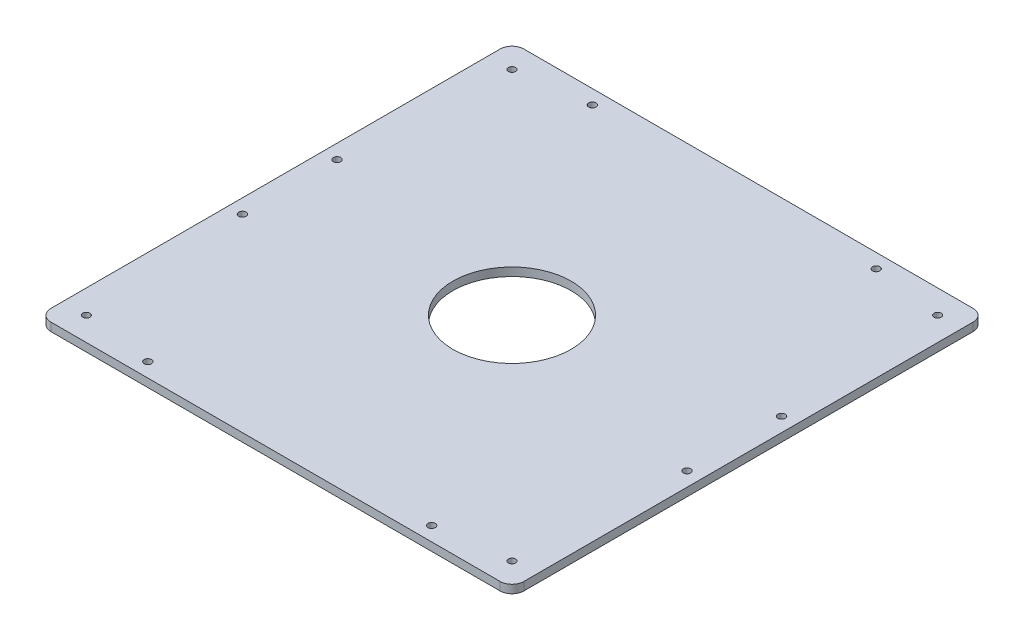
from build123d import *

# Parameters (mm, degrees)
SKETCH_1_R      = 1.55
SKETCH_1_R_2    = 25
SKETCH_1_R_3    = 1.5
EXTRUDE_1_DEPTH = 3.5
FILLET_1_R      = 5


with BuildPart() as part:
    # 草图1 → 凸台-拉伸1 (new body)
    with BuildSketch(Plane(origin=(0, 0, 0), x_dir=(1, 0, 0), z_dir=(0, 1, 0))):
        Polygon((-100, 100), (100, 100), (100, -32.687538375), (100, -80.687538375), (100, -100), (-100, -100), (-100, -80.687538375), (-100, -32.687538375), align=None)
        with Locations(Location((60, 94, 0), (0, 0, 270))):
            Circle(SKETCH_1_R, mode=Mode.SUBTRACT)
        with Locations(Location((60, -94, 0), (0, 0, 270))):
            Circle(SKETCH_1_R, mode=Mode.SUBTRACT)
        with Locations(Location((94, 20, 0), (0, 0, 270))):
            Circle(SKETCH_1_R, mode=Mode.SUBTRACT)
        with Locations(Location((94, -20, 0), (0, 0, 90))):
            Circle(SKETCH_1_R, mode=Mode.SUBTRACT)
        with Locations(Location((-60, -94, 0), (0, 0, 90))):
            Circle(SKETCH_1_R, mode=Mode.SUBTRACT)
        with Locations(Location((-94, -20, 0), (0, 0, 270))):
            Circle(SKETCH_1_R, mode=Mode.SUBTRACT)
        with Locations(Location((-94, 20, 0), (0, 0, 90))):
            Circle(SKETCH_1_R, mode=Mode.SUBTRACT)
        with Locations(Location((-60, 94, 0), (0, 0, 90))):
            Circle(SKETCH_1_R, mode=Mode.SUBTRACT)
        with Locations(Location((0, 0, 0), (0, 0, 270))):
            Circle(SKETCH_1_R_2, mode=Mode.SUBTRACT)
        with Locations(Location((-90, -90, 0), (0, 0, 270))):
            Circle(SKETCH_1_R_3, mode=Mode.SUBTRACT)
        with Locations(Location((-90, 90, 0), (0, 0, 90))):
            Circle(SKETCH_1_R_3, mode=Mode.SUBTRACT)
        with Locations(Location((90, 90, 0), (0, 0, 270))):
            Circle(SKETCH_1_R_3, mode=Mode.SUBTRACT)
        with Locations(Location((90, -90, 0), (0, 0, 90))):
            Circle(SKETCH_1_R_3, mode=Mode.SUBTRACT)
    extrude(amount=EXTRUDE_1_DEPTH)

    # 圆角1
    fillet_1_edges = [part.edges().sort_by_distance(p)[0] for p in [
        (-100, 1.75, -100),
        (100, 1.75, -100),
        (100, 1.75, 100),
        (-100, 1.75, 100),
    ]]
    fillet(fillet_1_edges, radius=FILLET_1_R)


solid = part.part
